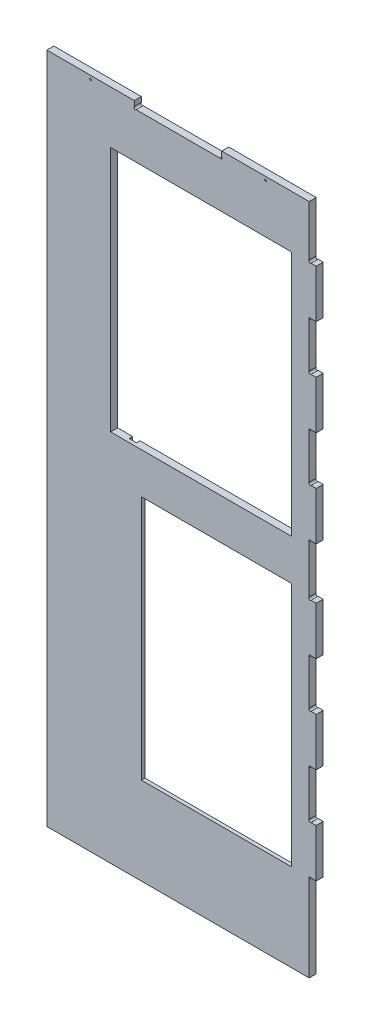
from build123d import *

# Parameters (mm, degrees)
ESQUISSE1_R             = 1
ESQUISSE1_W             = 207
ESQUISSE1_H             = 281.553390594
ESQUISSE1_W_2           = 172
ESQUISSE1_H_2           = 280.534461641
BOSS_EXTRU_1_DEPTH      = 8
ENL_V_MAT_EXTRU_2_DEPTH = 4
ENL_V_MAT_EXTRU_3_DEPTH = 4
ESQUISSE6_R             = 4
ENL_V_MAT_EXTRU_4_DEPTH = 6


with BuildPart() as part:
    # Esquisse1 → Boss.-Extru.1 (new body)
    with BuildSketch(Plane.XY):
        with BuildLine():
            Line((-54.650090097, -45.819197646), (-54.650090097, 358.028972494))
            Line((-54.650090097, 358.028972494), (-54.650090097, 722.896071587))
            Line((-54.650090097, 722.896071587), (45.349909903, 722.896071587))
            Line((45.349909903, 722.896071587), (45.349909903, 717.01739193))
            ThreePointArc((45.349909903, 717.01739193), (45.349909903, 714.896071587), (47.471230246, 714.896071587))
            Line((47.471230246, 714.896071587), (143.228589559, 714.896071587))
            ThreePointArc((143.228589559, 714.896071587), (145.349909903, 714.896071587), (145.349909903, 717.01739193))
            Line((145.349909903, 717.01739193), (145.349909903, 722.896071587))
            Line((145.349909903, 722.896071587), (245.349909903, 722.896071587))
            Line((245.349909903, 722.896071587), (245.349909903, 665.01739193))
            ThreePointArc((245.349909903, 665.01739193), (245.349909903, 662.896071587), (247.471230246, 662.896071587))
            Line((247.471230246, 662.896071587), (253.349909903, 662.896071587))
            Line((253.349909903, 662.896071587), (253.349909903, 607.896071587))
            Line((253.349909903, 607.896071587), (247.471230246, 607.896071587))
            ThreePointArc((247.471230246, 607.896071587), (245.349909903, 607.896071587), (245.349909903, 605.774751243))
            Line((245.349909903, 605.774751243), (245.349909903, 555.01739193))
            ThreePointArc((245.349909903, 555.01739193), (245.349909903, 552.896071587), (247.471230246, 552.896071587))
            Line((247.471230246, 552.896071587), (253.349909903, 552.896071587))
            Line((253.349909903, 552.896071587), (253.349909903, 497.896071587))
            Line((253.349909903, 497.896071587), (247.471230246, 497.896071587))
            ThreePointArc((247.471230246, 497.896071587), (245.349909903, 497.896071587), (245.349909903, 495.774751243))
            Line((245.349909903, 495.774751243), (245.349909903, 445.01739193))
            ThreePointArc((245.349909903, 445.01739193), (245.349909903, 442.896071587), (247.471230246, 442.896071587))
            Line((247.471230246, 442.896071587), (253.349909903, 442.896071587))
            Line((253.349909903, 442.896071587), (253.349909903, 387.896071587))
            Line((253.349909903, 387.896071587), (247.471230246, 387.896071587))
            ThreePointArc((247.471230246, 387.896071587), (245.349909903, 387.896071587), (245.349909903, 385.774751243))
            Line((245.349909903, 385.774751243), (245.349909903, 331.302122698))
            ThreePointArc((245.349909903, 331.302122698), (245.349909903, 329.180802354), (247.471230246, 329.180802354))
            Line((247.471230246, 329.180802354), (253.349909903, 329.180802354))
            Line((253.349909903, 329.180802354), (253.349909903, 274.180802354))
            Line((253.349909903, 274.180802354), (247.471230246, 274.180802354))
            ThreePointArc((247.471230246, 274.180802354), (245.349909903, 274.180802354), (245.349909903, 272.059482011))
            Line((245.349909903, 272.059482011), (245.349909903, 221.302122698))
            ThreePointArc((245.349909903, 221.302122698), (245.349909903, 219.180802354), (247.471230246, 219.180802354))
            Line((247.471230246, 219.180802354), (253.349909903, 219.180802354))
            Line((253.349909903, 219.180802354), (253.349909903, 164.180802354))
            Line((253.349909903, 164.180802354), (247.471230246, 164.180802354))
            ThreePointArc((247.471230246, 164.180802354), (245.349909903, 164.180802354), (245.349909903, 162.059482011))
            Line((245.349909903, 162.059482011), (245.349909903, 111.302122698))
            ThreePointArc((245.349909903, 111.302122698), (245.349909903, 109.180802354), (247.471230246, 109.180802354))
            Line((247.471230246, 109.180802354), (253.349909903, 109.180802354))
            Line((253.349909903, 109.180802354), (253.349909903, 54.180802354))
            Line((253.349909903, 54.180802354), (247.471230246, 54.180802354))
            ThreePointArc((247.471230246, 54.180802354), (245.349909903, 54.180802354), (245.349909903, 52.059482011))
            Line((245.349909903, 52.059482011), (245.349909903, -45.819197646))
            Line((245.349909903, -45.819197646), (-54.650090097, -45.819197646))
        make_face()
        with Locations((195.349909903, 718.896071587)):
            Circle(ESQUISSE1_R, mode=Mode.SUBTRACT)
        with Locations(Location((-4.650090097, 718.896071587, 0), (0, 0, 180))):
            Circle(ESQUISSE1_R, mode=Mode.SUBTRACT)
        with Locations((121.849909903, 522.11937629)):
            Rectangle(ESQUISSE1_W, ESQUISSE1_H, mode=Mode.SUBTRACT)
        with Locations((139.349909903, 194.448033175)):
            Rectangle(ESQUISSE1_W_2, ESQUISSE1_H_2, mode=Mode.SUBTRACT)
    extrude(amount=BOSS_EXTRU_1_DEPTH)

    # Esquisse3 → Enlèv. mat.-Extru.2 (cut)
    with BuildSketch(Plane(origin=(0, 0, 0), x_dir=(-1, 0, 0), z_dir=(0, 0, -1))):
        with BuildLine():
            Line((-228.228589559, 339.715263995), (-50.471230246, 339.715263995))
            ThreePointArc((-50.471230246, 339.715263995), (-48.349909903, 339.715263995), (-48.349909903, 337.593943652))
            Line((-48.349909903, 337.593943652), (-48.349909903, 51.302122698))
            ThreePointArc((-48.349909903, 51.302122698), (-48.349909903, 49.180802354), (-50.471230246, 49.180802354))
            Line((-50.471230246, 49.180802354), (-228.228589559, 49.180802354))
            ThreePointArc((-228.228589559, 49.180802354), (-230.349909903, 49.180802354), (-230.349909903, 51.302122698))
            Line((-230.349909903, 51.302122698), (-230.349909903, 337.593943652))
            ThreePointArc((-230.349909903, 337.593943652), (-230.349909903, 339.715263995), (-228.228589559, 339.715263995))
        make_face()
    extrude(amount=-ENL_V_MAT_EXTRU_2_DEPTH, mode=Mode.SUBTRACT)

    # Esquisse5 → Enlèv. mat.-Extru.3 (cut)
    with BuildSketch(Plane(origin=(0, 0, 0), x_dir=(-1, 0, 0), z_dir=(0, 0, -1))):
        with BuildLine():
            Line((-35.349909903, -45.819197646), (-43.849909903, -45.819197646))
            Line((-43.849909903, -45.819197646), (-43.849909903, 712.532944954))
            ThreePointArc((-43.849909903, 712.532944954), (-44.060076233, 714.785905254), (-41.807115933, 714.996071584))
            Line((-41.807115933, 714.996071584), (-37.392703873, 714.996071584))
            ThreePointArc((-37.392703873, 714.996071584), (-35.139743573, 714.785905254), (-35.349909903, 712.532944954))
            Line((-35.349909903, 712.532944954), (-35.349909903, -45.819197646))
        make_face()
    extrude(amount=-ENL_V_MAT_EXTRU_3_DEPTH, mode=Mode.SUBTRACT)

    # Esquisse6 → Enlèv. mat.-Extru.4 (cut)
    with BuildSketch(Plane(origin=(0, 0, 0), x_dir=(-1, 0, 0), z_dir=(0, 0, -1))):
        with Locations((34.650090097, -25.819197646)):
            Circle(ESQUISSE6_R)
    extrude(amount=-ENL_V_MAT_EXTRU_4_DEPTH, mode=Mode.SUBTRACT)


solid = part.part
